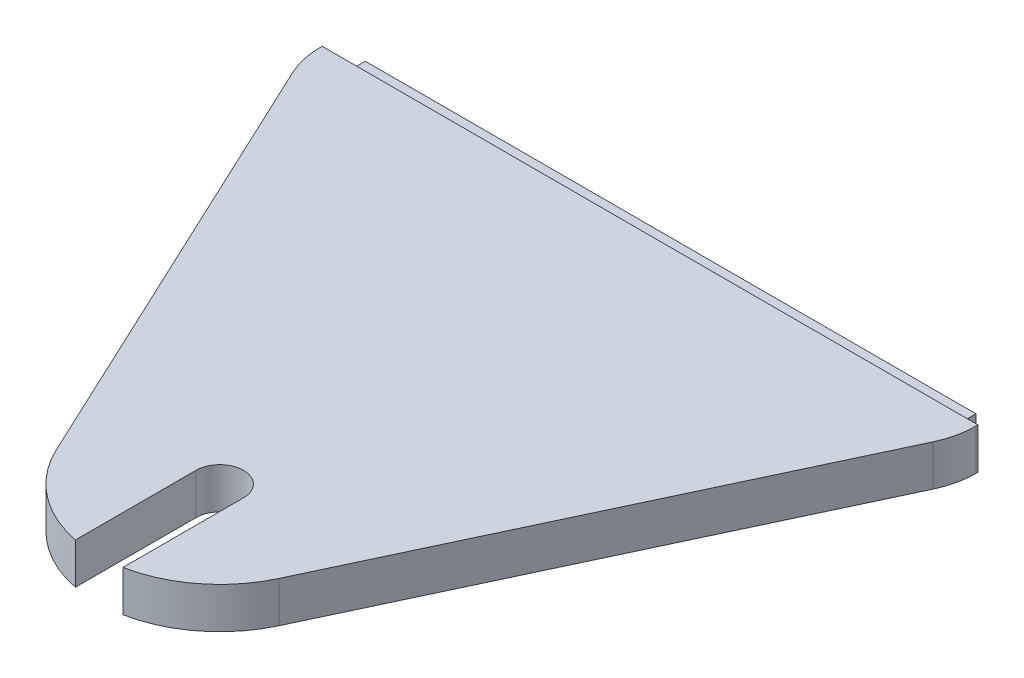
from build123d import *

# Parameters (mm, degrees)
BOSS_EXTRUDE1_DEPTH = 5
SKETCH3_W           = 80
SKETCH3_H           = 5
BOSS_EXTRUDE2_DEPTH = 5
SKETCH6_W           = 80
SKETCH6_H           = 5
SKETCH6_W_2         = 74.5
SKETCH6_H_2         = 2.1
CUT_EXTRUDE2_DEPTH  = 2.5
FILLET1_R           = 10
CUT_EXTRUDE3_DEPTH  = 5


with BuildPart() as part:
    # Sketch2 → Boss-Extrude1 (new body)
    with BuildSketch(Plane(origin=(0, 0, 0), x_dir=(1, 0, 0), z_dir=(0, 1, 0))):
        with BuildLine():
            Line((-40, 0), (40, 0))
            Line((40, 0), (13.582225242, -56.365780194))
            ThreePointArc((13.582225242, -56.365780194), (0, -65), (-13.582225242, -56.365780194))
            Line((-13.582225242, -56.365780194), (-40, 0))
        make_face()
    extrude(amount=BOSS_EXTRUDE1_DEPTH)

    # Sketch3 → Boss-Extrude2 (add)
    with BuildSketch(Plane(origin=(0, 0, 0), x_dir=(-1, 0, 0), z_dir=(0, 0, -1))):
        with Locations((0, 2.5)):
            Rectangle(SKETCH3_W, SKETCH3_H)
    extrude(amount=BOSS_EXTRUDE2_DEPTH)

    # Sketch6 → Cut-Extrude2 (cut)
    with BuildSketch(Plane(origin=(0, 0, -5), x_dir=(-1, 0, 0), z_dir=(0, 0, -1))):
        with Locations((0, 2.5)):
            Rectangle(SKETCH6_W, SKETCH6_H)
        with Locations((0, 2.5)):
            Rectangle(SKETCH6_W_2, SKETCH6_H_2, mode=Mode.SUBTRACT)
    extrude(amount=-CUT_EXTRUDE2_DEPTH, mode=Mode.SUBTRACT)

    # Fillet1
    fillet1_edges = [part.edges().sort_by_distance(p)[0] for p in [
        (-40, 2.5, 0),
        (40, 2.5, 0),
    ]]
    fillet(fillet1_edges, radius=FILLET1_R)

    # Sketch7 → Cut-Extrude3 (cut)
    with BuildSketch(Plane(origin=(0, 0, 0), x_dir=(-1, 0, 0), z_dir=(0, -1, 0))):
        with BuildLine():
            Line((2.9, -50), (2.9, -64.716996976))
            ThreePointArc((2.9, -64.716996976), (0, -65), (-2.9, -64.716996976))
            Line((-2.9, -64.716996976), (-2.9, -50))
            ThreePointArc((-2.9, -50), (0, -47.1), (2.9, -50))
        make_face()
    extrude(amount=-CUT_EXTRUDE3_DEPTH, mode=Mode.SUBTRACT)


solid = part.part
